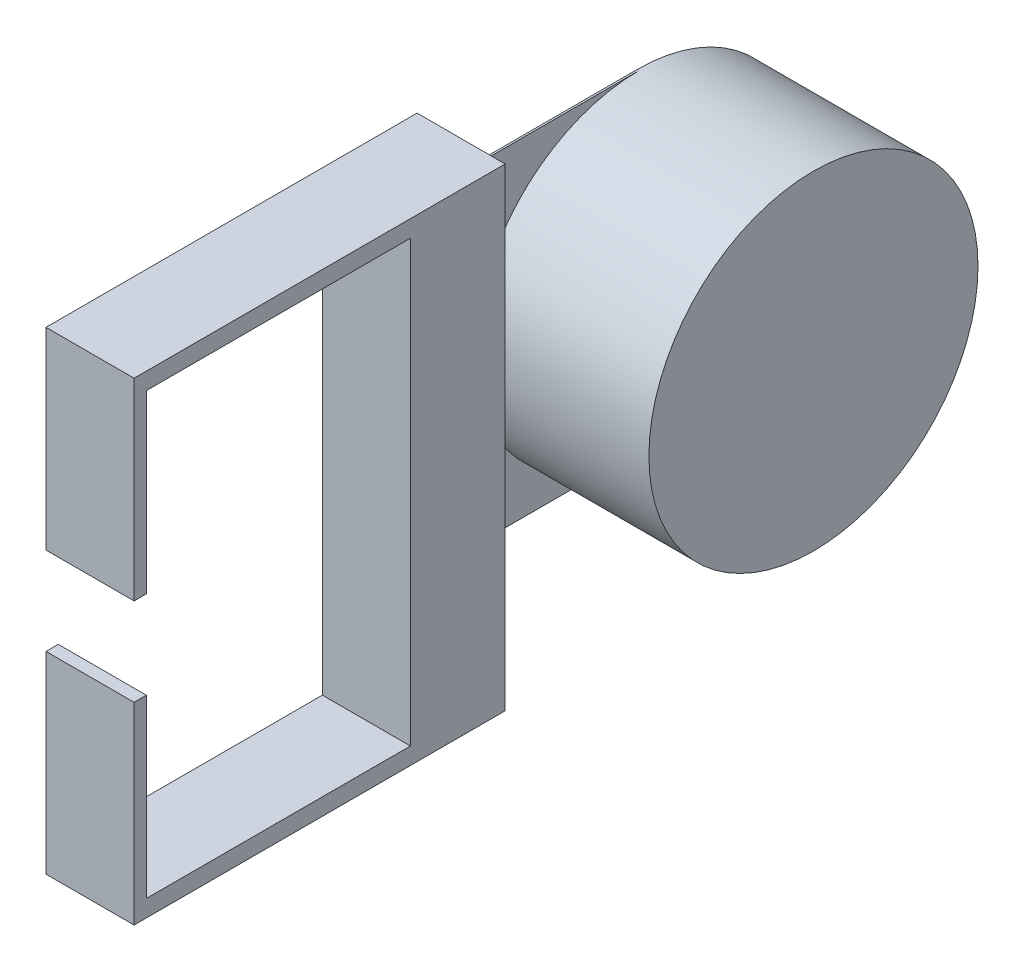
from build123d import *

# Parameters (mm, degrees)
SKETCH1_R           = 23.72487
BOSS_EXTRUDE1_DEPTH = 25.4
SKETCH2_W           = 47.44974
SKETCH2_H           = 0.27178
BOSS_EXTRUDE2_DEPTH = 31.75
SKETCH3_W           = 12.7
SKETCH3_H           = 68.28282
BOSS_EXTRUDE3_DEPTH = 13.65758
SKETCH4_W           = 12.7
SKETCH4_H           = 2.43586
BOSS_EXTRUDE4_DEPTH = 38.0746
SKETCH5_W           = 12.7
SKETCH5_H           = 27.81554
BOSS_EXTRUDE5_DEPTH = 1.77038


with BuildPart() as part:
    # Sketch1 → Boss-Extrude1 (new body)
    with BuildSketch(Plane.YZ):
        with Locations(Location((0, 0, 0), (0, 0, 270))):
            Circle(SKETCH1_R)
    extrude(amount=BOSS_EXTRUDE1_DEPTH)

    # Sketch2 → Boss-Extrude2 (add)
    with BuildSketch(Plane(origin=(0, 0, 0), x_dir=(0, 1, 0), z_dir=(0, 0, 1))):
        with Locations((0, -0.13589)):
            Rectangle(SKETCH2_W, SKETCH2_H)
    extrude(amount=BOSS_EXTRUDE2_DEPTH)

    # Sketch3 → Boss-Extrude3 (add)
    with BuildSketch(Plane.XY.offset(31.75)):
        with Locations((6.35, 0)):
            Rectangle(SKETCH3_W, SKETCH3_H)
    extrude(amount=BOSS_EXTRUDE3_DEPTH)

    # Sketch4 → Boss-Extrude4 (add)
    with BuildSketch(Plane.XY.offset(45.40758)):
        with Locations((6.35, 32.92348)):
            Rectangle(SKETCH4_W, SKETCH4_H)
        with Locations((6.35, -32.92348)):
            Rectangle(SKETCH4_W, SKETCH4_H)
    extrude(amount=BOSS_EXTRUDE4_DEPTH)

    # Sketch5 → Boss-Extrude5 (add)
    with BuildSketch(Plane.XY.offset(83.48218)):
        with Locations((6.35, 20.23364)):
            Rectangle(SKETCH5_W, SKETCH5_H)
        with Locations((6.35, -20.23364)):
            Rectangle(SKETCH5_W, SKETCH5_H)
    extrude(amount=BOSS_EXTRUDE5_DEPTH)


solid = part.part
